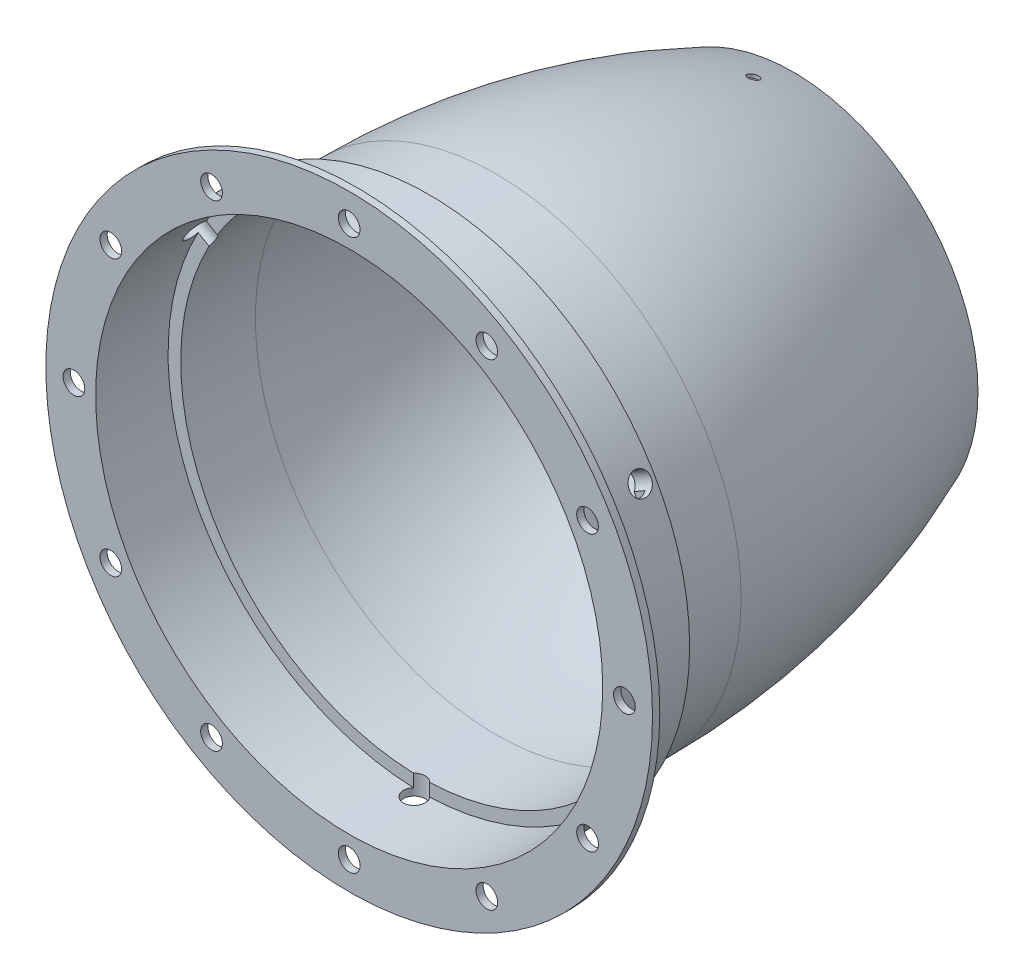
from build123d import *

# Parameters (mm, degrees)
ESQUISSE2_R                  = 1.5
ENL_V_MAT_EXTRU_1_DEPTH      = 86.23333422
ESQUISSE4_R                  = 1.5
ENL_V_MAT_EXTRU_2_DEPTH      = 86.23333422
R_P_TITION_CIRCULAIRE1_COUNT = 3
ESQUISSE5_R                  = 0.75
ENL_V_MAT_EXTRU_3_DEPTH      = 86.23333422


with BuildPart() as part:
    # Esquisse1 → Base-Révolution (revolve)
    with BuildSketch(Plane(origin=(0, 0, 0), x_dir=(0, 0, -1), z_dir=(1, 0, 0)), mode=Mode.PRIVATE) as base_r_volution_sk:
        with BuildLine():
            Line((0, 41.875), (0, 35))
            Line((0, 35), (10, 35))
            Line((10, 35), (10, 33.25))
            Line((10, 33.25), (20.3, 33.25))
            ThreePointArc((20.3, 33.25), (41.210897279, 31.167034961), (61.3, 25))
            Line((61.3, 25), (61.3, 25.5))
            ThreePointArc((61.3, 25.5), (41.215843277, 31.704165587), (20.3, 33.8))
            Line((20.3, 33.8), (11, 33.8))
            Line((11, 33.8), (11, 36))
            Line((11, 36), (1, 36))
            Line((1, 36), (1, 41.875))
            Line((1, 41.875), (0, 41.875))
        make_face()
    revolve(base_r_volution_sk.sketch.rotate(Axis((0, 0, 48.008611825), (0, 0, -1)), 90), axis=Axis((0, 0, 48.008611825), (0, 0, -1)))

    # Esquisse2 → Enlèv. mat.-Extru.1 (cut, through all)
    with BuildSketch(Plane.XY):
        with Locations((0, -37.995)):
            Circle(ESQUISSE2_R)
        with Locations((0, 38)):
            Circle(ESQUISSE2_R)
        with Locations((-18.9975, -32.904635217)):
            Circle(ESQUISSE2_R)
        with Locations((-37.995, 0)):
            Circle(ESQUISSE2_R)
        with Locations((-32.904635217, 18.9975)):
            Circle(ESQUISSE2_R)
        with Locations((-18.9975, 32.904635217)):
            Circle(ESQUISSE2_R)
        with Locations((18.9975, 32.904635217)):
            Circle(ESQUISSE2_R)
        with Locations((32.904635217, 18.9975)):
            Circle(ESQUISSE2_R)
        with Locations((37.995, 0)):
            Circle(ESQUISSE2_R)
        with Locations((18.9975, -32.904635217)):
            Circle(ESQUISSE2_R)
        with Locations((32.908965344, -19)):
            Circle(ESQUISSE2_R)
        with Locations((-32.908965344, -19)):
            Circle(ESQUISSE2_R)
    extrude(amount=-ENL_V_MAT_EXTRU_1_DEPTH, mode=Mode.SUBTRACT)

    # Esquisse4 → Enlèv. mat.-Extru.2 (cut, through all)
    with BuildSketch(Plane(origin=(0, 0, 0), x_dir=(1, 0, 0), z_dir=(0, 1, 0))):
        with Locations(Location((0, 9, 0), (0, 0, 270))):
            Circle(ESQUISSE4_R)
    enl_v_mat_extru_2 = extrude(amount=-ENL_V_MAT_EXTRU_2_DEPTH, mode=Mode.SUBTRACT)

    # Répétition circulaire1: Enlèv. mat.-Extru.2 ×3 about axis
    r_p_tition_circulaire1_axis = Axis((0, 0, 48.008611825), (0, 0, -1))
    for i in range(1, R_P_TITION_CIRCULAIRE1_COUNT):
        add(enl_v_mat_extru_2.rotate(r_p_tition_circulaire1_axis, i * 360 / R_P_TITION_CIRCULAIRE1_COUNT), mode=Mode.SUBTRACT)

    # Esquisse5 → Enlèv. mat.-Extru.3 (cut, through all)
    with BuildSketch(Plane(origin=(0, 0, 0), x_dir=(0, 0, -1), z_dir=(0, 1, 0))):
        with Locations(Location((55.8, 0, 0), (0, 0, 30.651170267))):
            Circle(ESQUISSE5_R)
    extrude(amount=ENL_V_MAT_EXTRU_3_DEPTH, mode=Mode.SUBTRACT)


solid = part.part
